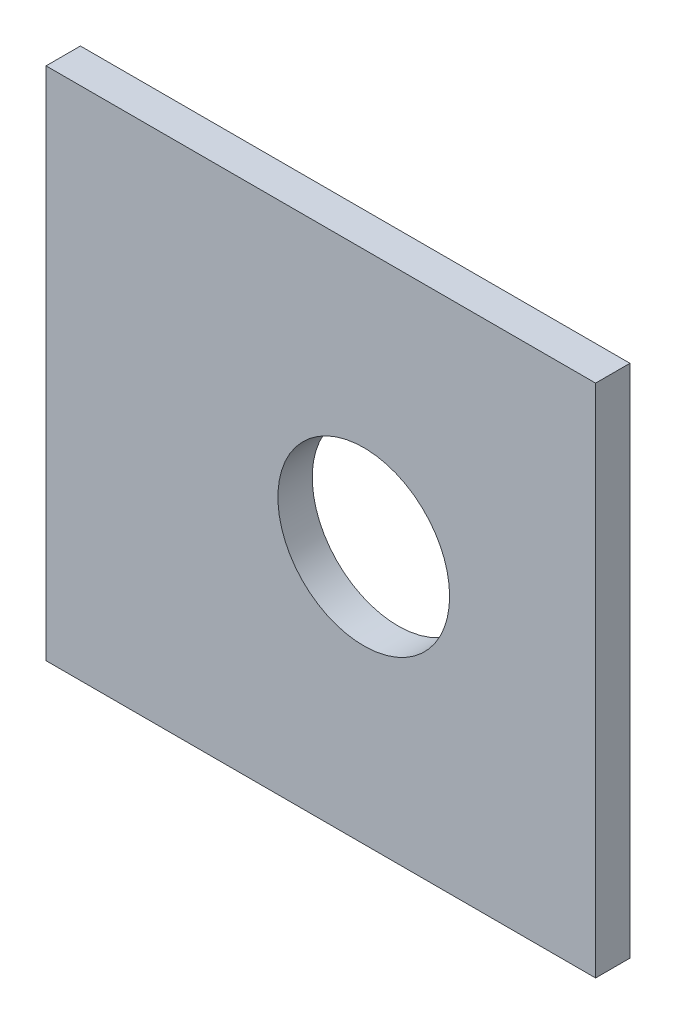
from build123d import *

# Parameters (mm, degrees)
SKETCH1_W           = 64
SKETCH1_H           = 60
SKETCH1_R           = 10
BOSS_EXTRUDE1_DEPTH = 4


with BuildPart() as part:
    # Sketch1 → Boss-Extrude1 (new body)
    with BuildSketch(Plane.XY):
        with Locations((-5, 0)):
            Rectangle(SKETCH1_W, SKETCH1_H)
        Circle(SKETCH1_R, mode=Mode.SUBTRACT)
    extrude(amount=BOSS_EXTRUDE1_DEPTH)


solid = part.part
